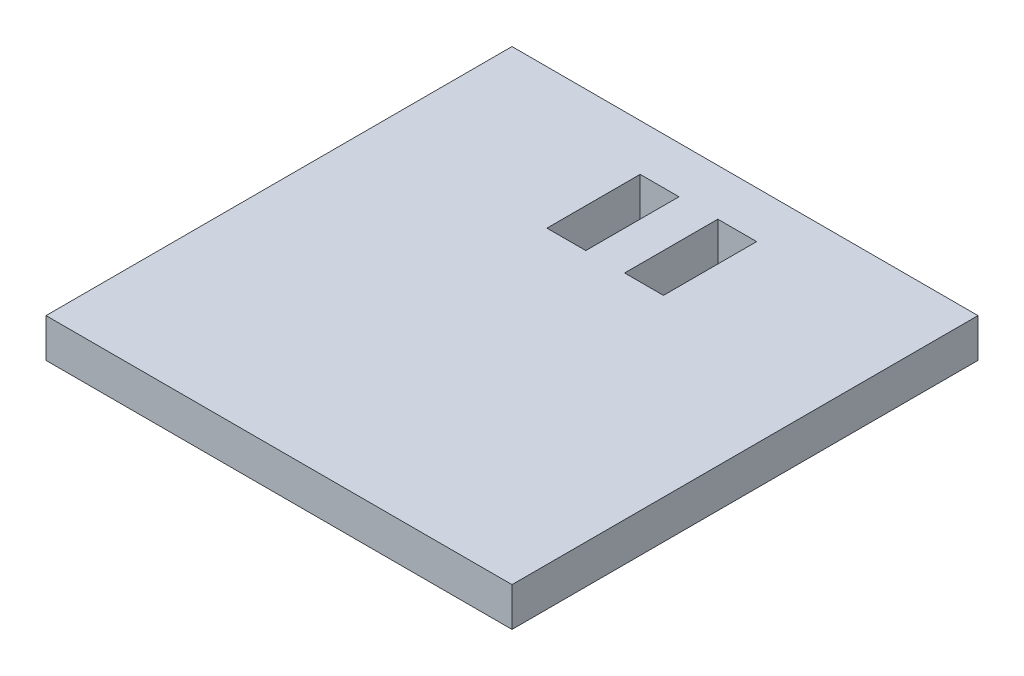
from build123d import *

# Parameters (mm, degrees)
SKETCH1_W           = 38.1
SKETCH1_H           = 38.1
SKETCH1_W_2         = 3.175
SKETCH1_H_2         = 7.62
BOSS_EXTRUDE1_DEPTH = 3.175


with BuildPart() as part:
    # Sketch1 → Boss-Extrude1 (new body)
    with BuildSketch(Plane(origin=(0, 0, 0), x_dir=(1, 0, 0), z_dir=(0, 1, 0))):
        with Locations((19.05, 19.05)):
            Rectangle(SKETCH1_W, SKETCH1_H)
        with Locations((15.875, 30.48)):
            Rectangle(SKETCH1_W_2, SKETCH1_H_2, mode=Mode.SUBTRACT)
        with Locations((22.225, 30.48)):
            Rectangle(SKETCH1_W_2, SKETCH1_H_2, mode=Mode.SUBTRACT)
    extrude(amount=BOSS_EXTRUDE1_DEPTH)


solid = part.part
